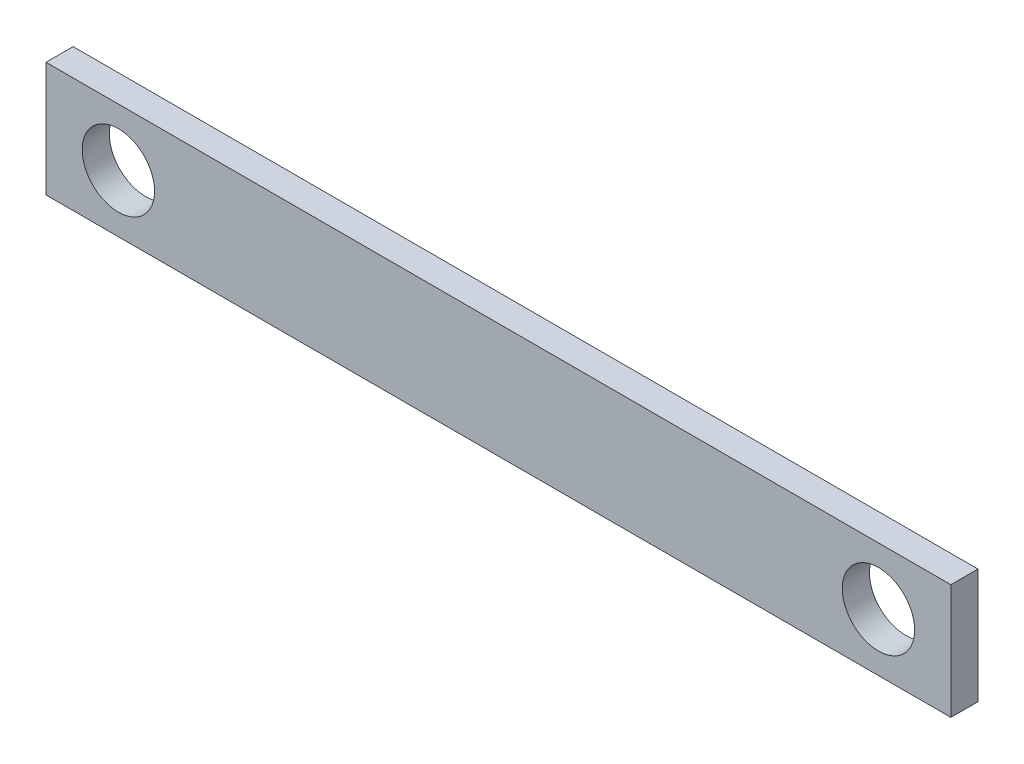
from build123d import *

# Parameters (mm, degrees)
CROQUIS1_W              = 100
CROQUIS1_H              = 12.7
CROQUIS1_R              = 4
SALIENTE_EXTRUIR1_DEPTH = 3


with BuildPart() as part:
    # Croquis1 → Saliente-Extruir1 (new body)
    with BuildSketch(Plane.XY):
        Rectangle(CROQUIS1_W, CROQUIS1_H)
        with Locations((-42, 0)):
            Circle(CROQUIS1_R, mode=Mode.SUBTRACT)
        with Locations(Location((42, 0, 0), (0, 0, 180))):
            Circle(CROQUIS1_R, mode=Mode.SUBTRACT)
    extrude(amount=SALIENTE_EXTRUIR1_DEPTH)


solid = part.part
